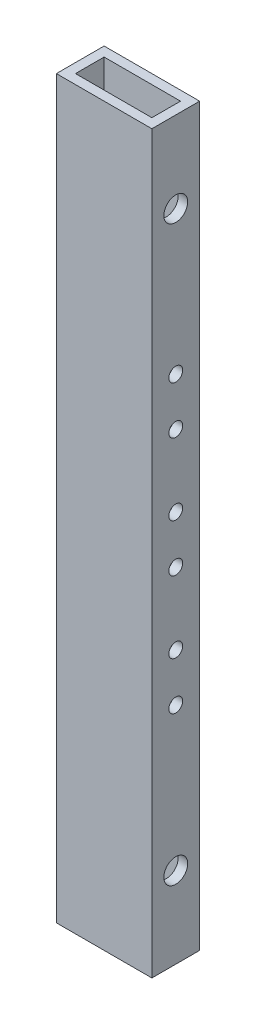
from build123d import *

# Parameters (mm, degrees)
SKETCH_1_W          = 20
SKETCH_1_H          = 10
SKETCH_1_W_2        = 16
SKETCH_1_H_2        = 6
EXTRUDE_1_DEPTH     = 77
SKETCH_2_R          = 1.45
SKETCH_2_R_2        = 2.5
CUT_EXTRUDE_1_DEPTH = 80.711981534


with BuildPart() as part:
    # 草图1 → 凸台-拉伸1 (new, symmetric)
    with BuildSketch(Plane(origin=(0, 0, 0), x_dir=(1, 0, 0), z_dir=(0, 1, 0))):
        Rectangle(SKETCH_1_W, SKETCH_1_H)
        Rectangle(SKETCH_1_W_2, SKETCH_1_H_2, mode=Mode.SUBTRACT)
    extrude(amount=EXTRUDE_1_DEPTH, both=True)

    # 草图2 → 切除-拉伸1 (cut, through all)
    with BuildSketch(Plane(origin=(10, 0, 0), x_dir=(0, 0, -1), z_dir=(1, 0, 0))):
        with Locations((0, 5)):
            Circle(SKETCH_2_R)
        with Locations((0, 20)):
            Circle(SKETCH_2_R)
        with Locations((0, 30)):
            Circle(SKETCH_2_R)
        with Locations((0, -30)):
            Circle(SKETCH_2_R)
        with Locations((0, -20)):
            Circle(SKETCH_2_R)
        with Locations((0, -5)):
            Circle(SKETCH_2_R)
        with Locations((0, 60)):
            Circle(SKETCH_2_R_2)
        with Locations((0, -60)):
            Circle(SKETCH_2_R_2)
    extrude(amount=-CUT_EXTRUDE_1_DEPTH, mode=Mode.SUBTRACT)


solid = part.part
